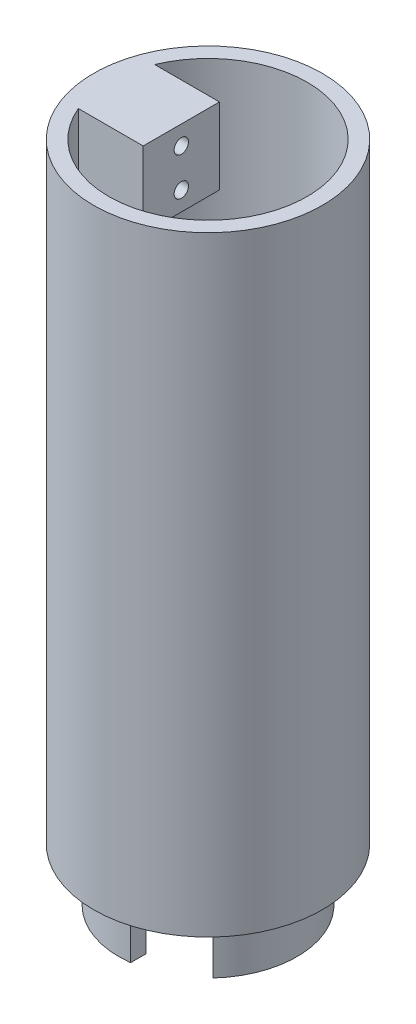
from build123d import *

# Parameters (mm, degrees)
SKETCH1_R               = 19.05
BOSS_EXTRUDE1_DEPTH     = 50.8
SKETCH2_R               = 14.82725
BOSS_EXTRUDE2_DEPTH     = 8.89
CUT_EXTRUDE2_DEPTH      = 114.727064061
CUT_EXTRUDE2_DEPTH_BACK = 95.25
SKETCH4_R               = 16.51
CUT_EXTRUDE3_REACH      = 115.727
SKETCH5_R               = 12.28725
BOSS_EXTRUDE3_START     = -16.51
SKETCH8_W               = 12.7
SKETCH8_H               = 12.7
BOSS_EXTRUDE3_DEPTH     = 12.065
CUT_EXTRUDE5_DEPTH      = 66.488175269
CUT_EXTRUDE5_DEPTH_BACK = 66.488175269
SKETCH9_W               = 9.046009644
SKETCH9_H               = 7.62
SKETCH10_W              = 12.7
SKETCH10_H              = 3.81
BOSS_EXTRUDE4_DEPTH     = 7.62
CUT_EXTRUDE6_DEPTH      = 67.067470248
CUT_EXTRUDE6_DEPTH_BACK = 67.067470248
SKETCH11_R              = 2.4
SKETCH12_R              = 1.2
CUT_EXTRUDE7_DEPTH      = 67.916467517
CUT_EXTRUDE8_DEPTH      = 15.845


with BuildPart() as part:
    # Sketch1 → Boss-Extrude1 (new, symmetric)
    with BuildSketch(Plane(origin=(0, 0, 0), x_dir=(1, 0, 0), z_dir=(0, 1, 0))):
        with Locations(Location((0, 0, 0), (0, 0, 270))):
            Circle(SKETCH1_R)
    extrude(amount=BOSS_EXTRUDE1_DEPTH, both=True)

    # Sketch2 → Boss-Extrude2 (add)
    with BuildSketch(Plane.XZ.offset(50.8)):
        with Locations(Location((0, 0, 0), (0, 0, 270))):
            Circle(SKETCH2_R)
    extrude(amount=BOSS_EXTRUDE2_DEPTH)

    # Sketch4 → Cut-Extrude2 (cut, two sides: drawn at the far end of the back side and taken through both)
    with BuildSketch(Plane(origin=(0, 50.8, 0), x_dir=(1, 0, 0), z_dir=(0, 1, 0)).offset(-CUT_EXTRUDE2_DEPTH_BACK)):
        with Locations(Location((0, 0, 0), (0, 0, 270))):
            Circle(SKETCH4_R)
    extrude(amount=CUT_EXTRUDE2_DEPTH + CUT_EXTRUDE2_DEPTH_BACK, mode=Mode.SUBTRACT)

    # Sketch5 → Cut-Extrude3 (cut, up to next)
    with BuildSketch(Plane.XZ.offset(59.69), mode=Mode.PRIVATE) as cut_extrude3_sk1:
        with Locations(Location((0, 0, 0), (0, 0, 270))):
            Circle(SKETCH5_R)
    cut_extrude3_tool1 = extrude(cut_extrude3_sk1.sketch, amount=-CUT_EXTRUDE3_REACH, mode=Mode.PRIVATE) & part.part
    add(cut_extrude3_tool1.solids().sort_by_distance((0, -59.69, 0))[0], mode=Mode.SUBTRACT)

    # Sketch8 → Boss-Extrude3 (add)
    with BuildSketch(Plane(origin=(0, 0, 0), x_dir=(0, 0, -1), z_dir=(1, 0, 0)).offset(BOSS_EXTRUDE3_START)):
        with Locations((0, 44.45)):
            Rectangle(SKETCH8_W, SKETCH8_H)
    extrude(amount=BOSS_EXTRUDE3_DEPTH)

    # Sketch9 → Cut-Extrude5 (cut, two sides: drawn at the far end of the back side and taken through both)
    with BuildSketch(Plane.XY.offset(-CUT_EXTRUDE5_DEPTH_BACK)):
        with Locations((6.35, -55.88)):
            Rectangle(SKETCH9_W, SKETCH9_H)
    extrude(amount=CUT_EXTRUDE5_DEPTH + CUT_EXTRUDE5_DEPTH_BACK, mode=Mode.SUBTRACT)

    # Sketch10 → Boss-Extrude4 (add)
    with BuildSketch(Plane.XZ.offset(59.69)):
        with Locations((8.354363895, 0)):
            Rectangle(SKETCH10_W, SKETCH10_H)
    extrude(amount=-BOSS_EXTRUDE4_DEPTH)

    # Sketch11 → Cut-Extrude6 (cut, two sides: drawn at the far end of the back side and taken through both)
    with BuildSketch(Plane.XY.offset(1.905).offset(-CUT_EXTRUDE6_DEPTH_BACK)):
        with Locations((6.35, -55.88)):
            Circle(SKETCH11_R)
    extrude(amount=CUT_EXTRUDE6_DEPTH + CUT_EXTRUDE6_DEPTH_BACK, mode=Mode.SUBTRACT)

    # Sketch12 → Cut-Extrude7 (cut, through all)
    with BuildSketch(Plane(origin=(-4.445, 0, 0), x_dir=(0, 0, -1), z_dir=(1, 0, 0))):
        with Locations((0, 41.275)):
            Circle(SKETCH12_R)
        with Locations((0, 47.625)):
            Circle(SKETCH12_R)
    extrude(amount=-CUT_EXTRUDE7_DEPTH, mode=Mode.SUBTRACT)

    # Sketch14 → Cut-Extrude8 (cut)
    with BuildSketch(Plane.ZY.offset(25.4)):
        with BuildLine():
            Line((-2.921, 41.275), (-2.921, 47.625))
            ThreePointArc((-2.921, 47.625), (0, 50.546), (2.921, 47.625))
            Line((2.921, 47.625), (2.921, 41.275))
            ThreePointArc((2.921, 41.275), (0, 38.354), (-2.921, 41.275))
        make_face()
    extrude(amount=-CUT_EXTRUDE8_DEPTH, mode=Mode.SUBTRACT)


solid = part.part
